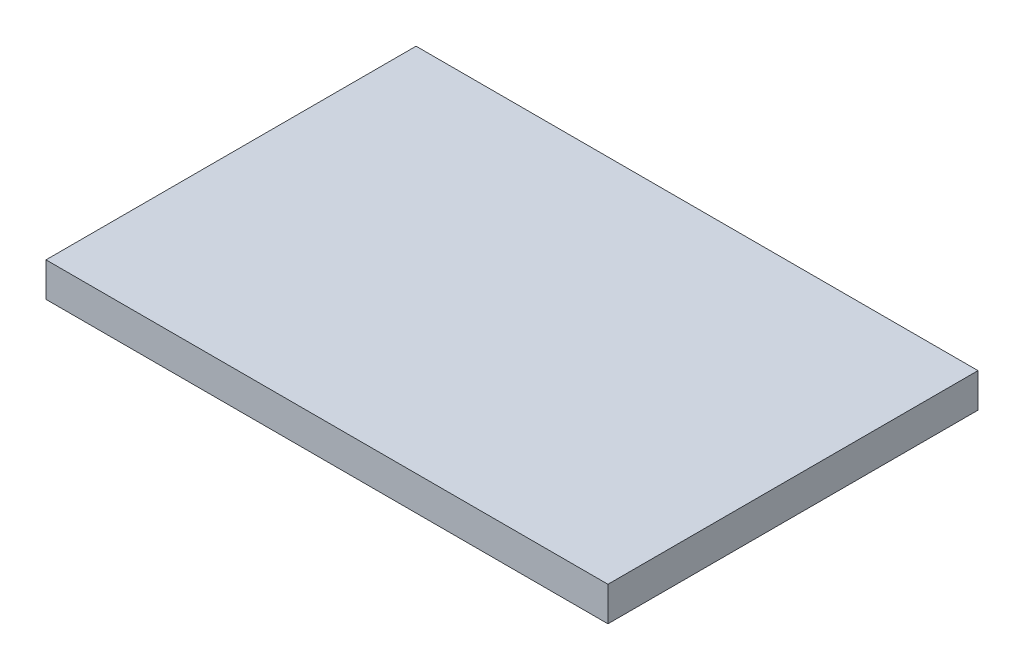
from build123d import *

# Parameters (mm, degrees)
SKETCH3_W           = 164
SKETCH3_H           = 108
BOSS_EXTRUDE1_DEPTH = 10


with BuildPart() as part:
    # Sketch3 → Boss-Extrude1 (new body)
    with BuildSketch(Plane(origin=(0, 0, 0), x_dir=(1, 0, 0), z_dir=(0, 1, 0))):
        with Locations((82, 54)):
            Rectangle(SKETCH3_W, SKETCH3_H)
    extrude(amount=BOSS_EXTRUDE1_DEPTH)


solid = part.part
